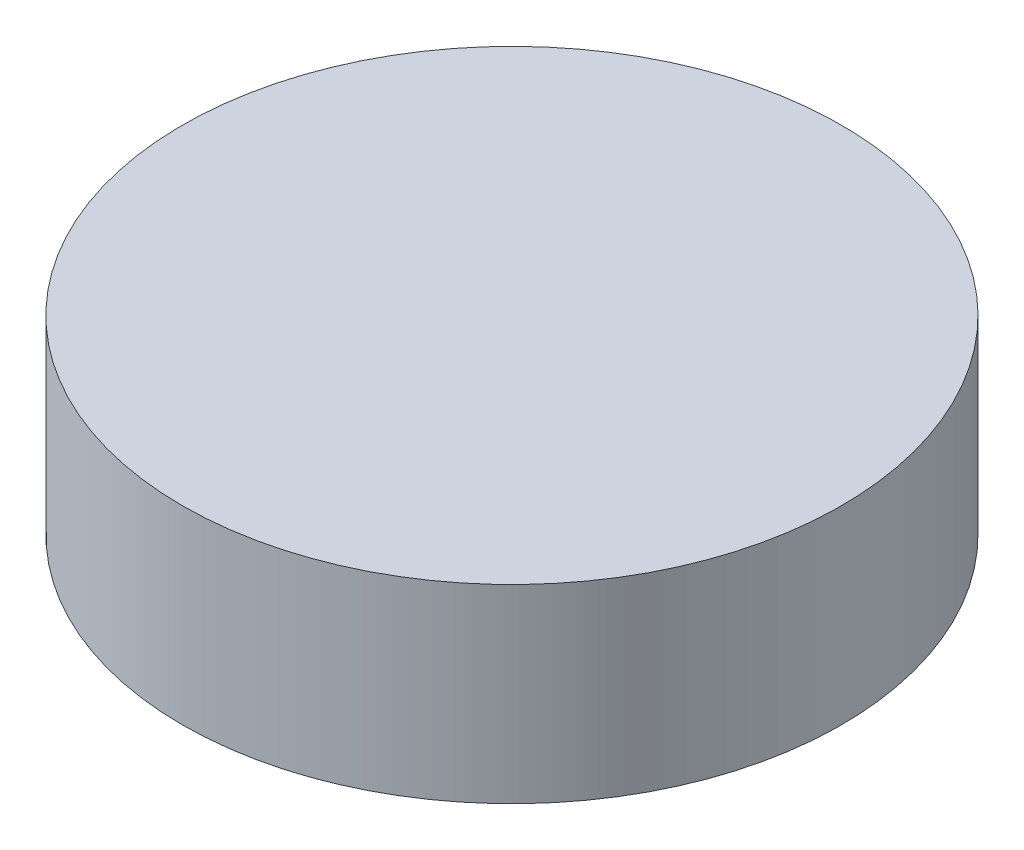
from build123d import *

# Parameters (mm, degrees)
SKETCH1_R           = 7.9375
BOSS_EXTRUDE1_DEPTH = 4.572


with BuildPart() as part:
    # Sketch1 → Boss-Extrude1 (new body)
    with BuildSketch(Plane(origin=(0, 0, 0), x_dir=(1, 0, 0), z_dir=(0, 1, 0))):
        with Locations(Location((0, 0, 0), (0, 0, 270))):
            Circle(SKETCH1_R)
    extrude(amount=BOSS_EXTRUDE1_DEPTH)


solid = part.part
